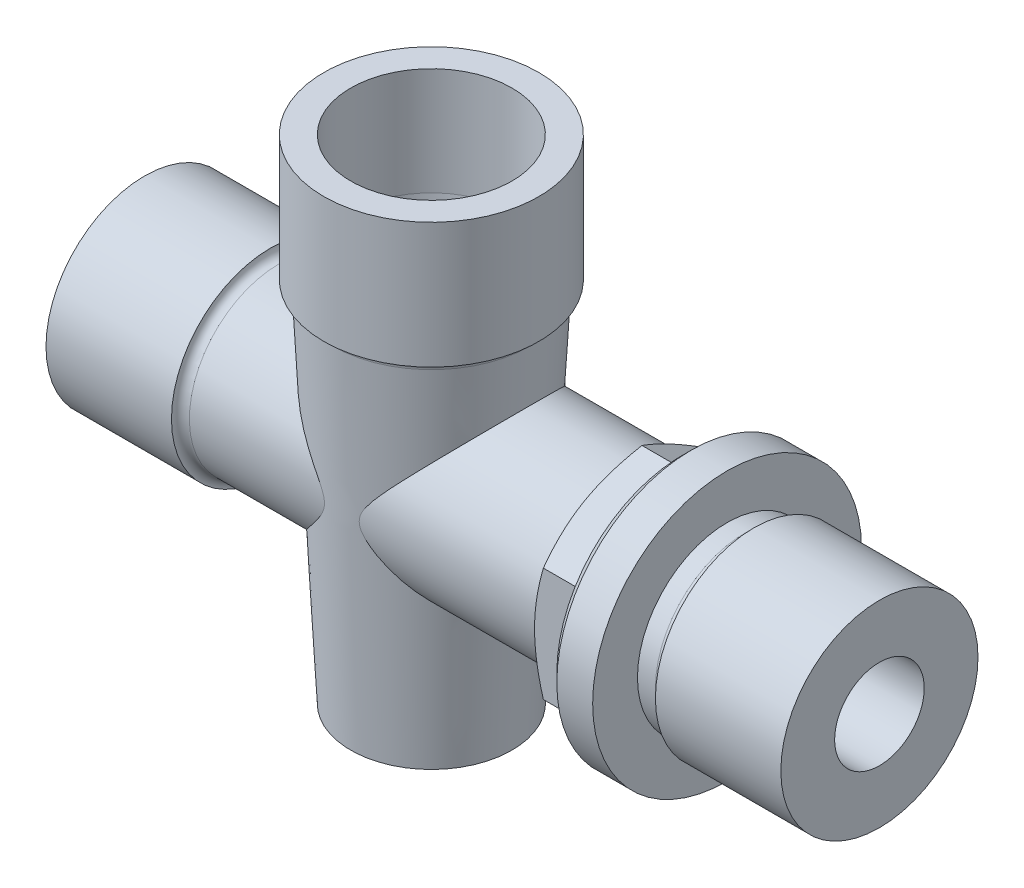
from build123d import *
from build123d.topology import SkipClean

# Parameters (mm, degrees)
SKETCH_4_R      = 5
EXTRUDE_1_DEPTH = 6
SKETCH_7_W      = 82
SKETCH_7_H      = 5


with BuildPart() as part:
    # Эскиз1 → Повернуть1 (revolve)
    with BuildSketch(Plane.XY, mode=Mode.PRIVATE) as revolve_1_sk:
        with BuildLine():
            Line((0, 0), (-9, 0))
            Line((-9, 0), (-11.001246108, 40.049906542))
            ThreePointArc((-11.001246108, 40.049906542), (-11.310763662, 40.72453659), (-12, 41))
            Line((-12, 41), (-12, 55))
            Line((-12, 55), (-9, 55))
            Line((-9, 55), (-9, 43))
            Line((-9, 43), (-5.5, 7))
            Line((-5.5, 7), (-7.5, 7))
            Line((-7.5, 7), (-7.5, 5))
            Line((-7.5, 5), (0, 5))
            Line((0, 5), (0, 0))
        make_face()
    revolve(revolve_1_sk.sketch.rotate(Axis((0, 0, 0), (0, 1, 0)), 270), axis=Axis((0, 0, 0), (0, 1, 0)))


with BuildPart() as body_2:
    # Эскиз2 → Повернуть2 (revolve)
    with BuildSketch(Plane.XY, mode=Mode.PRIVATE) as revolve_2_sk:
        with BuildLine():
            Line((-32, 19), (0, 19))
            Line((0, 19), (0, 14))
            Line((0, 14), (-17, 14))
            ThreePointArc((-17, 14), (-17.707106781, 13.707106781), (-18, 13))
            Line((-18, 13), (-32, 13))
            Line((-32, 13), (-32, 19))
        make_face()
    revolve(revolve_2_sk.sketch.rotate(Axis((0, 24, 0), (-1, 0, 0)), 180), axis=Axis((0, 24, 0), (-1, 0, 0)))


with BuildPart() as body_3:
    # Эскиз3 → Повернуть3 (revolve)
    with BuildSketch(Plane.XY, mode=Mode.PRIVATE) as revolve_3_sk:
        with BuildLine():
            Line((50, 29), (50, 35))
            Line((50, 35), (36, 35))
            ThreePointArc((36, 35), (35.707106781, 34.292893219), (35, 34))
            Line((35, 34), (33, 34))
            Line((33, 34), (33, 39))
            Line((33, 39), (29, 39))
            Line((29, 39), (28, 38))
            Line((28, 38), (28, 34))
            Line((28, 34), (0, 34))
            Line((0, 34), (0, 29))
            Line((0, 29), (50, 29))
        make_face()
    revolve(revolve_3_sk.sketch.rotate(Axis((0, 24, 0), (1, 0, 0)), 90), axis=Axis((0, 24, 0), (1, 0, 0)))


with BuildPart() as body_4:
    # Эскиз4 → Бобышка-Вытянуть1 (new body)
    with BuildSketch(Plane.ZY.offset(-28)):
        Polygon((0, 36.701705922), (-11, 30.350852961), (-11, 17.649147039), (0, 11.298294078), (11, 17.649147039), (11, 30.350852961), align=None)
        with Locations(Location((0, 24, 0), (0, 0, 90))):
            Circle(SKETCH_4_R, mode=Mode.SUBTRACT)
    extrude(amount=EXTRUDE_1_DEPTH)

    # Эскиз5 → Вырез-Повернуть2 (revolve, cut)
    with BuildSketch(Plane.XY):
        Polygon((23.5, 36.701705922), (19.695105977, 30.111436158), (17.010668104, 30.111436158), (17.010668104, 41.083076525), (23.5, 41.083076525), align=None)
    revolve(axis=Axis((28, 24, 0), (-1, 0, 0)), mode=Mode.SUBTRACT)

    # Combine 1: union body 3
    add(body_3.part)


with BuildPart() as part_1:
    add(part.part)

    # Combine 2: union body 2, body 4
    add(body_2.part)
    add(body_4.part)

    # Эскиз6 → Вырез-Повернуть3 (revolve, cut)
    with BuildSketch(Plane.XY, mode=Mode.PRIVATE) as cut_revolve_3_sk:
        Polygon((0, 55), (-9, 55), (-9, 43), (-5.5, 7), (-7.5, 7), (-7.5, 5), (0, 5), align=None)
    revolve(cut_revolve_3_sk.sketch.rotate(Axis((0, 0, 0), (0, 1, 0)), 270), axis=Axis((0, 0, 0), (0, 1, 0)), mode=Mode.SUBTRACT)

    # Эскиз7 → Вырез-Повернуть4 (revolve, cut)
    with SkipClean():  # the faces are left unmerged after this step: merging them gives an invalid solid
        with BuildSketch(Plane.XY, mode=Mode.PRIVATE) as cut_revolve_4_sk:
            with Locations((9, 21.5)):
                Rectangle(SKETCH_7_W, SKETCH_7_H)
        revolve(cut_revolve_4_sk.sketch.rotate(Axis((0, 24, 0), (-1, 0, 0)), 90), axis=Axis((0, 24, 0), (-1, 0, 0)), mode=Mode.SUBTRACT)


solid = part_1.part
